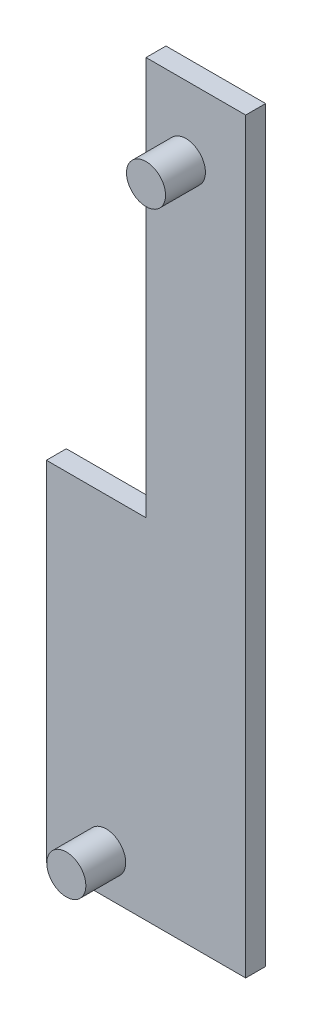
from build123d import *

# Parameters (mm, degrees)
SKETCH1_W           = 50
SKETCH1_H           = 187.5
BOSS_EXTRUDE1_DEPTH = 5
SKETCH2_R           = 4.9
BOSS_EXTRUDE2_DEPTH = 10
SKETCH3_W           = 25
SKETCH3_H           = 100
CUT_EXTRUDE1_DEPTH  = 10


with BuildPart() as part:
    # Sketch1 → Boss-Extrude1 (new body)
    with BuildSketch(Plane.XY):
        with Locations((25, 93.75)):
            Rectangle(SKETCH1_W, SKETCH1_H)
    extrude(amount=BOSS_EXTRUDE1_DEPTH)

    # Sketch2 → Boss-Extrude2 (add)
    with BuildSketch(Plane.XY.offset(5)):
        with Locations(Location((15, 10, 0), (0, 0, 180))):
            Circle(SKETCH2_R)
        with Locations(Location((35, 170, 0), (0, 0, 180))):
            Circle(SKETCH2_R)
    extrude(amount=BOSS_EXTRUDE2_DEPTH)

    # Sketch3 → Cut-Extrude1 (cut)
    with BuildSketch(Plane.XY.offset(5)):
        with Locations((12.5, 137.5)):
            Rectangle(SKETCH3_W, SKETCH3_H)
    extrude(amount=-CUT_EXTRUDE1_DEPTH, mode=Mode.SUBTRACT)


solid = part.part
